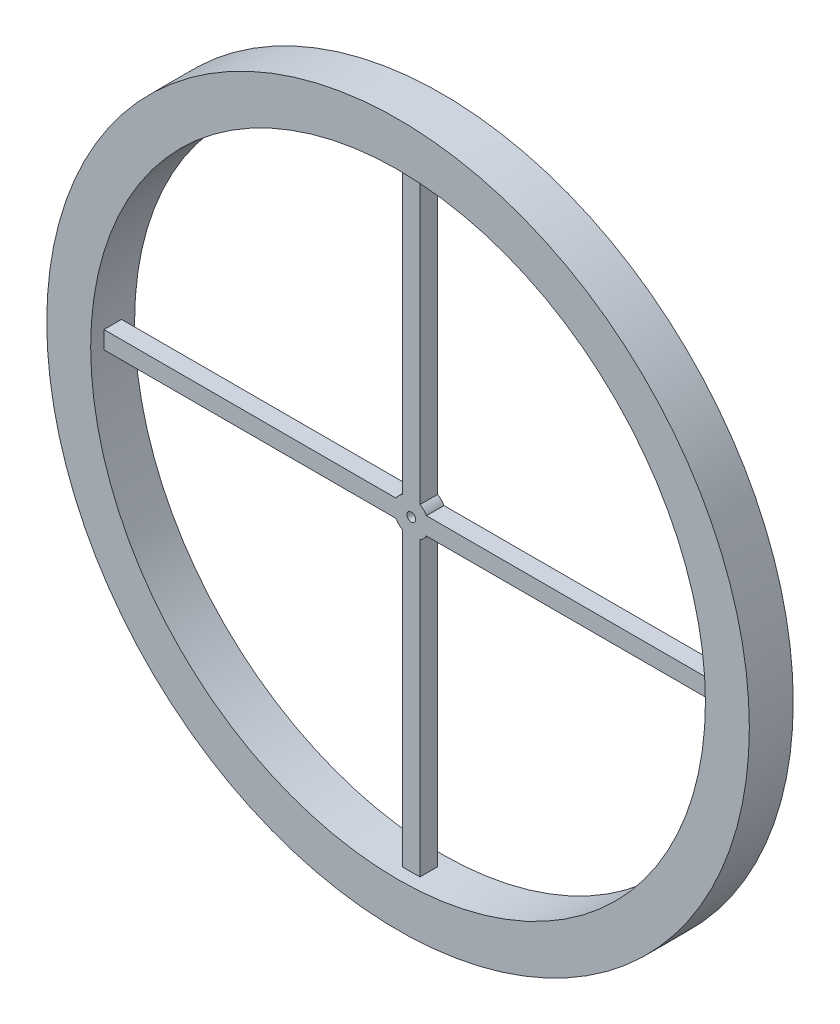
from build123d import *
from build123d.topology import SkipClean

# Parameters (mm, degrees)
BOSS_EXTRUDE1_DEPTH = 1
CIRPATTERN1_COUNT   = 4
SKETCH3_R           = 40
SKETCH3_R_2         = 35
BOSS_EXTRUDE2_DEPTH = 2.5


with BuildPart() as part:
    # Sketch1 → Boss-Extrude1 (new, symmetric)
    with BuildSketch(Plane.XY):
        with BuildLine():
            Line((0, 40), (0, 0.5))
            ThreePointArc((0, 0.5), (-0.353553391, 0.353553391), (-0.5, 0))
            Line((-0.5, 0), (-40, 0))
            ThreePointArc((-40, 0), (-28.284271247, 28.284271247), (0, 40))
        make_face()
        with BuildLine():
            Line((-1, 34.985711369), (-1, 1.732050808))
            ThreePointArc((-1, 1.732050808), (-1.414213562, 1.414213562), (-1.732050808, 1))
            Line((-1.732050808, 1), (-34.985711369, 1))
            ThreePointArc((-34.985711369, 1), (-24.748737342, 24.748737342), (-1, 34.985711369))
        make_face(mode=Mode.SUBTRACT)
    boss_extrude1 = extrude(amount=BOSS_EXTRUDE1_DEPTH, both=True)

    # CirPattern1: Boss-Extrude1 ×4 about axis
    cirpattern1_axis = Axis((0, 0, 0), (0, 0, 1))
    for i in range(1, CIRPATTERN1_COUNT):
        add(boss_extrude1.rotate(cirpattern1_axis, i * 360 / CIRPATTERN1_COUNT))

    # Sketch3 → Boss-Extrude2 (add, symmetric)
    with SkipClean():  # the faces are left unmerged after this step: merging them gives an invalid solid
        with BuildSketch(Plane.XY):
            Circle(SKETCH3_R)
            Circle(SKETCH3_R_2, mode=Mode.SUBTRACT)
        extrude(amount=BOSS_EXTRUDE2_DEPTH, both=True)


solid = part.part
